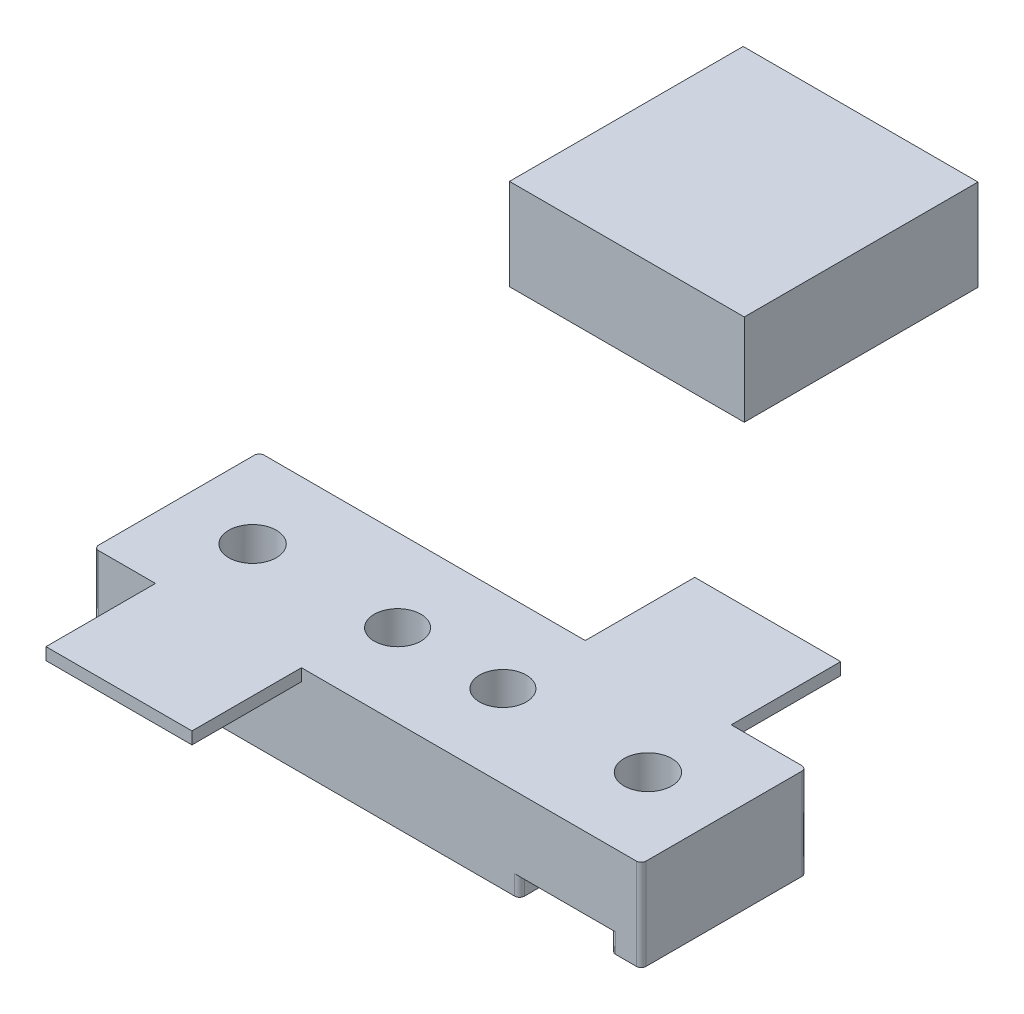
from build123d import *

# Parameters (mm, degrees)
SKETCH1_W              = 57.15
SKETCH1_H              = 17.272
SKETCH1_R              = 2.4384
BOSS_EXTRUDE1_DEPTH    = 9.525
F_10_CLEARANCE_HOLE1_D = 4.9784
SKETCH4_W              = 9.525
SKETCH4_H              = 17.272
CUT_EXTRUDE1_DEPTH     = 2.032
FILLET1_R              = 0.508
SKETCH5_W              = 24.516541507
SKETCH5_H              = 24.401843065
BOSS_EXTRUDE2_DEPTH    = 9.525
SKETCH6_W              = 15.24
SKETCH6_H              = 11.43
BOSS_EXTRUDE3_DEPTH    = 1.27


with BuildPart() as part:
    # Sketch1 → Boss-Extrude1 (new body)
    with BuildSketch(Plane(origin=(0, 0, 0), x_dir=(1, 0, 0), z_dir=(0, 1, 0))):
        Rectangle(SKETCH1_W, SKETCH1_H)
        with Locations(Location((-5.4991, 0, 0), (0, 0, 90))):
            Circle(SKETCH1_R, mode=Mode.SUBTRACT)
        with Locations(Location((5.4991, 0, 0), (0, 0, 90))):
            Circle(SKETCH1_R, mode=Mode.SUBTRACT)
    extrude(amount=BOSS_EXTRUDE1_DEPTH)

    # #10 Clearance Hole1 (through all)
    with Locations(Plane(origin=(0, 9.525, 0), x_dir=(1, 0, 0), z_dir=(0, 1, 0))):
        with Locations((-20.6375, 0), (20.6375, 0)):
            Hole(F_10_CLEARANCE_HOLE1_D / 2)

    # Sketch4 → Cut-Extrude1 (cut)
    with BuildSketch(Plane.XZ):
        with Locations((-20.6375, 0)):
            Rectangle(SKETCH4_W, SKETCH4_H)
    cut_extrude1 = extrude(amount=-CUT_EXTRUDE1_DEPTH, mode=Mode.SUBTRACT)

    # Mirror1: Cut-Extrude1 across plane
    add(cut_extrude1.mirror(Plane(origin=(0, 0, 0), x_dir=(0, 0, 1), z_dir=(1, 0, 0))), mode=Mode.SUBTRACT)

    # Fillet1
    fillet1_edges = [part.edges().sort_by_distance(p)[0] for p in [
        (-15.875, 1.016, -8.636),
        (-25.4, 1.016, -8.636),
        (-25.4, 1.016, 8.636),
        (-15.875, 1.016, 8.636),
        (25.4, 1.016, -8.636),
        (15.875, 1.016, -8.636),
        (15.875, 1.016, 8.636),
        (25.4, 1.016, 8.636),
        (28.575, 4.7625, -8.636),
        (28.575, 4.7625, 8.636),
        (-28.575, 4.7625, 8.636),
        (-28.575, 4.7625, -8.636),
    ]]
    fillet(fillet1_edges, radius=FILLET1_R)

    # Sketch6 → Boss-Extrude3 (add)
    with BuildSketch(Plane(origin=(0, 9.525, 0), x_dir=(1, 0, 0), z_dir=(0, 1, 0))):
        with Locations((13.079142729, 14.351)):
            Rectangle(SKETCH6_W, SKETCH6_H)
        with Locations((-14.520274695, -14.351)):
            Rectangle(SKETCH6_W, SKETCH6_H)
    extrude(amount=-BOSS_EXTRUDE3_DEPTH)


with BuildPart() as body_2:
    # Sketch5 → Boss-Extrude2 (new body)
    with BuildSketch(Plane(origin=(0, 9.525, 0), x_dir=(1, 0, 0), z_dir=(0, 1, 0))):
        with Locations((-27.755611122, 58.397000049)):
            Rectangle(SKETCH5_W, SKETCH5_H)
    extrude(amount=-BOSS_EXTRUDE2_DEPTH)


solid = Compound([part.part, body_2.part])
